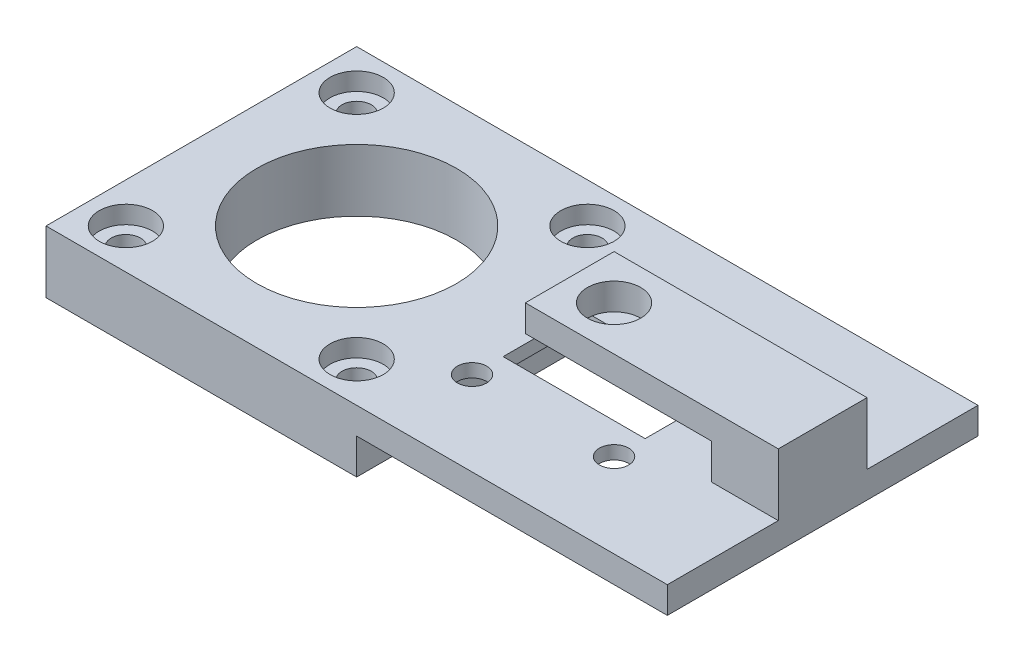
from build123d import *

# Parameters (mm, degrees)
SKETCH1_W               = 70
SKETCH1_H               = 35
BOSS_EXTRUDE1_DEPTH     = 3
BOSS_EXTRUDE2_START     = -3
SKETCH3_W               = 35
SKETCH3_H               = 35
BOSS_EXTRUDE2_DEPTH     = 4
CUT_EXTRUDE1_DEPTH      = 40.752358421
CUT_EXTRUDE1_DEPTH_BACK = 40.752358421
SKETCH2_R               = 1.65
SKETCH2_R_2             = 11.25
SKETCH5_R               = 3
CUT_EXTRUDE3_DEPTH      = 2
SKETCH6_R               = 1.65
SKETCH6_W               = 16
SKETCH6_H               = 9
CUT_EXTRUDE4_DEPTH      = 40.33509883
SKETCH7_W               = 24
SKETCH7_H               = 24
CUT_EXTRUDE5_DEPTH      = 1.5
SKETCH8_W               = 7.5
SKETCH8_H               = 10
BOSS_EXTRUDE3_DEPTH     = 7
SKETCH9_W               = 10
SKETCH9_H               = 3
BOSS_EXTRUDE4_DEPTH     = 21
CUT_EXTRUDE6_REACH      = 43.56
SKETCH10_R              = 3


with BuildPart() as part:
    # Sketch1 → Boss-Extrude1 (new body)
    with BuildSketch(Plane(origin=(0, 0, 0), x_dir=(1, 0, 0), z_dir=(0, 1, 0))):
        Rectangle(SKETCH1_W, SKETCH1_H)
    extrude(amount=BOSS_EXTRUDE1_DEPTH)

    # Sketch3 → Boss-Extrude2 (add)
    with BuildSketch(Plane(origin=(0, 3, 0), x_dir=(1, 0, 0), z_dir=(0, 1, 0)).offset(BOSS_EXTRUDE2_START)):
        with Locations((-17.5, 0)):
            Rectangle(SKETCH3_W, SKETCH3_H)
    extrude(amount=-BOSS_EXTRUDE2_DEPTH)

    # Sketch2 → Cut-Extrude1 (cut, two sides: drawn at the far end of the back side and taken through both)
    with BuildSketch(Plane(origin=(0, 3, 0), x_dir=(1, 0, 0), z_dir=(0, 1, 0)).offset(-CUT_EXTRUDE1_DEPTH_BACK)):
        with Locations(Location((-30.5, 13, 0), (0, 0, 270))):
            Circle(SKETCH2_R)
        with Locations(Location((-4.5, 13, 0), (0, 0, 90))):
            Circle(SKETCH2_R)
        with Locations(Location((-4.5, -13, 0), (0, 0, 270))):
            Circle(SKETCH2_R)
        with Locations(Location((-30.5, -13, 0), (0, 0, 90))):
            Circle(SKETCH2_R)
        with Locations(Location((-17.5, 0, 0), (0, 0, 270))):
            Circle(SKETCH2_R_2)
    extrude(amount=CUT_EXTRUDE1_DEPTH + CUT_EXTRUDE1_DEPTH_BACK, mode=Mode.SUBTRACT)

    # Sketch5 → Cut-Extrude3 (cut)
    with BuildSketch(Plane(origin=(0, 3, 0), x_dir=(1, 0, 0), z_dir=(0, 1, 0))):
        with Locations(Location((-30.5, 13, 0), (0, 0, 270))):
            Circle(SKETCH5_R)
        with Locations(Location((-4.5, 13, 0), (0, 0, 90))):
            Circle(SKETCH5_R)
        with Locations(Location((-4.5, -13, 0), (0, 0, 270))):
            Circle(SKETCH5_R)
        with Locations(Location((-30.5, -13, 0), (0, 0, 90))):
            Circle(SKETCH5_R)
    extrude(amount=-CUT_EXTRUDE3_DEPTH, mode=Mode.SUBTRACT)

    # Sketch6 → Cut-Extrude4 (cut, through all)
    with BuildSketch(Plane.XZ):
        with Locations(Location((3.5, 8, 0), (0, 0, 270))):
            Circle(SKETCH6_R)
        with Locations(Location((19.5, 8, 0), (0, 0, 90))):
            Circle(SKETCH6_R)
        with Locations(Location((19.5, -8, 0), (0, 0, 270))):
            Circle(SKETCH6_R)
        with Locations(Location((3.5, -8, 0), (0, 0, 90))):
            Circle(SKETCH6_R)
        with Locations((11.5, 0)):
            Rectangle(SKETCH6_W, SKETCH6_H)
    extrude(amount=-CUT_EXTRUDE4_DEPTH, mode=Mode.SUBTRACT)

    # Sketch7 → Cut-Extrude5 (cut)
    with BuildSketch(Plane(origin=(0, 0, 0), x_dir=(-1, 0, 0), z_dir=(0, -1, 0))):
        with Locations((-12, 0)):
            Rectangle(SKETCH7_W, SKETCH7_H)
    extrude(amount=-CUT_EXTRUDE5_DEPTH, mode=Mode.SUBTRACT)

    # Sketch8 → Boss-Extrude3 (add)
    with BuildSketch(Plane(origin=(0, 3, 0), x_dir=(1, 0, 0), z_dir=(0, 1, 0))):
        with Locations((31.25, 0)):
            Rectangle(SKETCH8_W, SKETCH8_H)
    extrude(amount=BOSS_EXTRUDE3_DEPTH)

    # Sketch9 → Boss-Extrude4 (add)
    with BuildSketch(Plane.ZY.offset(-27.5)):
        with Locations((0, 8.5)):
            Rectangle(SKETCH9_W, SKETCH9_H)
    extrude(amount=BOSS_EXTRUDE4_DEPTH)

    # Sketch10 → Cut-Extrude6 (cut, up to next)
    with BuildSketch(Plane(origin=(0, 10, 0), x_dir=(1, 0, 0), z_dir=(0, 1, 0)), mode=Mode.PRIVATE) as cut_extrude6_sk1:
        with Locations(Location((11.5, 0, 0), (0, 0, 270))):
            Circle(SKETCH10_R)
    cut_extrude6_tool1 = extrude(cut_extrude6_sk1.sketch, amount=-CUT_EXTRUDE6_REACH, mode=Mode.PRIVATE) & part.part
    add(cut_extrude6_tool1.solids().sort_by_distance((11.5, 10, 0))[0], mode=Mode.SUBTRACT)


solid = part.part
